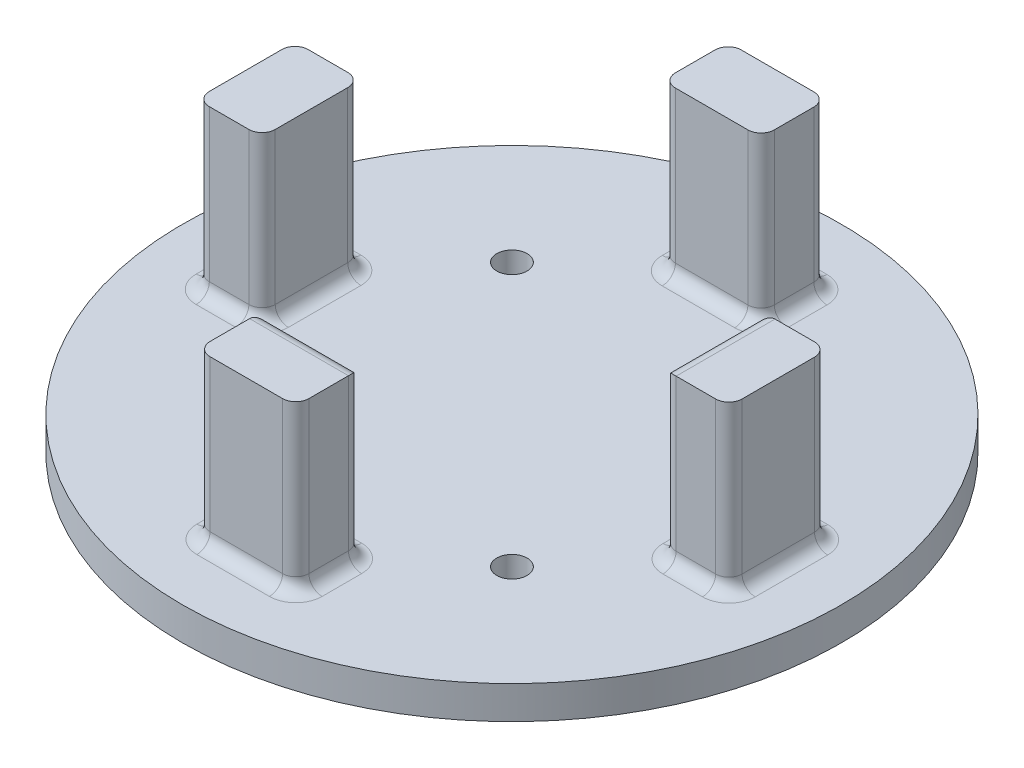
from build123d import *

# Parameters (mm, degrees)
SKETCH2_R           = 63.5
SKETCH2_R_2         = 2.921
BOSS_EXTRUDE2_DEPTH = 6.35
SKETCH3_W           = 19.05
SKETCH3_H           = 12.7
SKETCH3_W_2         = 12.7
SKETCH3_H_2         = 19.05
BOSS_EXTRUDE3_DEPTH = 31.75
FILLET1_R           = 2.54


with BuildPart() as part:
    # Sketch2 → Boss-Extrude2 (new body)
    with BuildSketch(Plane(origin=(0, 0, 0), x_dir=(1, 0, 0), z_dir=(0, 1, 0))):
        with Locations(Location((0, 0, 0), (0, 0, 270))):
            Circle(SKETCH2_R)
        with Locations(Location((-25.4, 25.4, 0), (0, 0, 270))):
            Circle(SKETCH2_R_2, mode=Mode.SUBTRACT)
        with Locations(Location((25.4, 25.4, 0), (0, 0, 270))):
            Circle(SKETCH2_R_2, mode=Mode.SUBTRACT)
        with Locations(Location((25.4, -25.4, 0), (0, 0, 270))):
            Circle(SKETCH2_R_2, mode=Mode.SUBTRACT)
        with Locations(Location((-25.4, -25.4, 0), (0, 0, 270))):
            Circle(SKETCH2_R_2, mode=Mode.SUBTRACT)
    extrude(amount=BOSS_EXTRUDE2_DEPTH)

    # Sketch3 → Boss-Extrude3 (add)
    with BuildSketch(Plane(origin=(0, 6.35, 0), x_dir=(1, 0, 0), z_dir=(0, 1, 0))):
        with Locations((0, 44.831)):
            Rectangle(SKETCH3_W, SKETCH3_H)
        with Locations((0, -44.831)):
            Rectangle(SKETCH3_W, SKETCH3_H)
        with Locations((-44.971451378, 0)):
            Rectangle(SKETCH3_W_2, SKETCH3_H_2)
        with Locations((44.971451378, 0)):
            Rectangle(SKETCH3_W_2, SKETCH3_H_2)
    extrude(amount=BOSS_EXTRUDE3_DEPTH)

    # Fillet1
    fillet1_edges = [part.edges().sort_by_distance(p)[0] for p in [
        (9.525, 6.35, -44.831),
        (9.525, 22.225, -38.481),
        (0, 6.35, -51.181),
        (9.525, 22.225, -51.181),
        (-9.525, 6.35, -44.831),
        (-9.525, 22.225, -51.181),
        (0, 6.35, -38.481),
        (-9.525, 22.225, -38.481),
        (-9.525, 6.35, 44.831),
        (-9.525, 22.225, 38.481),
        (0, 6.35, 51.181),
        (-9.525, 22.225, 51.181),
        (9.525, 6.35, 44.831),
        (9.525, 22.225, 51.181),
        (0, 6.35, 38.481),
        (9.525, 22.225, 38.481),
        (0, 38.1, 38.481),
        (-38.621451378, 6.35, 0),
        (-38.621451378, 22.225, 9.525),
        (-44.971451378, 6.35, -9.525),
        (-38.621451378, 22.225, -9.525),
        (-51.321451378, 6.35, 0),
        (-51.321451378, 22.225, -9.525),
        (-44.971451378, 6.35, 9.525),
        (-51.321451378, 22.225, 9.525),
        (44.971451378, 6.35, -9.525),
        (51.321451378, 22.225, -9.525),
        (38.621451378, 6.35, 0),
        (38.621451378, 22.225, -9.525),
        (44.971451378, 6.35, 9.525),
        (38.621451378, 22.225, 9.525),
        (51.321451378, 6.35, 0),
        (51.321451378, 22.225, 9.525),
        (38.621451378, 38.1, 0),
    ]]
    fillet(fillet1_edges, radius=FILLET1_R)


solid = part.part
